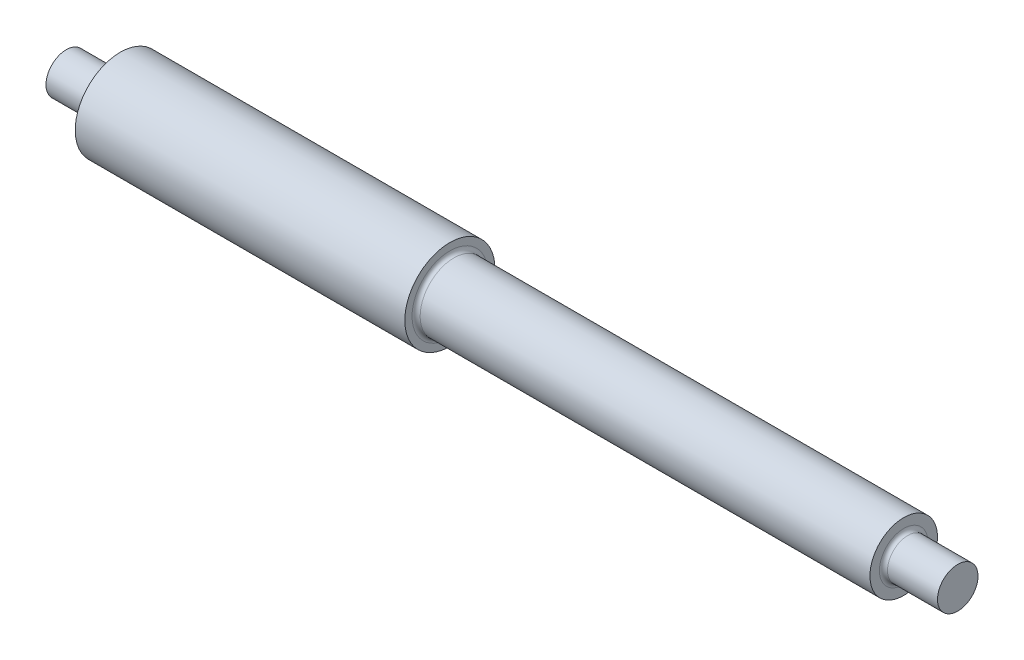
from build123d import *


with BuildPart() as part:
    # Sketch1 → Revolve1 (revolve)
    with BuildSketch(Plane.XY):
        with BuildLine():
            Line((0, 0), (0, 7.5))
            Line((0, 7.5), (18.5, 7.5))
            ThreePointArc((18.5, 7.5), (19.560660172, 7.939339828), (20, 9))
            Line((20, 9), (20, 16.675))
            Line((20, 16.675), (142, 16.675))
            Line((142, 16.675), (142, 14))
            ThreePointArc((142, 14), (142.439339828, 12.939339828), (143.5, 12.5))
            Line((143.5, 12.5), (310, 12.5))
            Line((310, 12.5), (310, 9))
            ThreePointArc((310, 9), (310.439339828, 7.939339828), (311.5, 7.5))
            Line((311.5, 7.5), (330, 7.5))
            Line((330, 7.5), (330, 0))
            Line((330, 0), (0, 0))
        make_face()
    revolve(axis=Axis((330, 0, 0), (-1, 0, 0)))


solid = part.part
